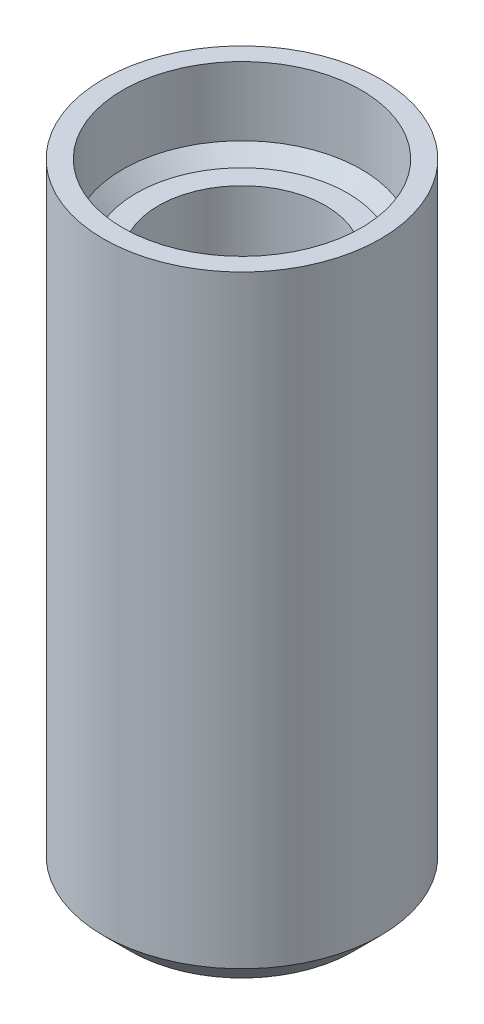
from build123d import *

# Parameters (mm, degrees)
SKETCH1_R           = 5.05
BOSS_EXTRUDE1_DEPTH = 20
SKETCH2_R           = 5.05
BOSS_EXTRUDE2_DEPTH = 2
SKETCH4_R           = 5.05
SKETCH4_R_2         = 4.35
BOSS_EXTRUDE3_DEPTH = 3
CHAMFER1_SIZE       = 1
CHAMFER2_SIZE       = 0.5
CUT_EXTRUDE1_DEPTH  = 0.4
BOSS_EXTRUDE4_DEPTH = 0.4


with BuildPart() as part:
    # Sketch1 → Boss-Extrude1 (new body)
    with BuildSketch(Plane(origin=(0, 0, 0), x_dir=(1, 0, 0), z_dir=(0, 1, 0))):
        Circle(SKETCH1_R)
        with BuildLine():
            Line((2.565151068, -1.65), (-2.565151068, -1.65))
            ThreePointArc((-2.565151068, -1.65), (0, 3.05), (2.565151068, -1.65))
        make_face(mode=Mode.SUBTRACT)
    extrude(amount=BOSS_EXTRUDE1_DEPTH)

    # Sketch2 → Boss-Extrude2 (add)
    with BuildSketch(Plane.XZ):
        Circle(SKETCH2_R)
    extrude(amount=-BOSS_EXTRUDE2_DEPTH)

    # Sketch4 → Boss-Extrude3 (add)
    with BuildSketch(Plane(origin=(0, 20, 0), x_dir=(1, 0, 0), z_dir=(0, 1, 0))):
        Circle(SKETCH4_R)
        Circle(SKETCH4_R_2, mode=Mode.SUBTRACT)
    extrude(amount=BOSS_EXTRUDE3_DEPTH)

    # Chamfer1
    chamfer1_edges = [part.edges().sort_by_distance(p)[0] for p in [
        (-5.05, 0, 0),
    ]]
    chamfer(chamfer1_edges, length=CHAMFER1_SIZE)

    # Chamfer2
    chamfer2_edges = [part.edges().sort_by_distance(p)[0] for p in [
        (-4.35, 20, 0),
    ]]
    chamfer(chamfer2_edges, length=CHAMFER2_SIZE)

    # Sketch5 → Cut-Extrude1 (cut)
    with BuildSketch(Plane.XZ):
        with BuildLine():
            add(Edge.make_bspline(
                [(1.439948587, 1.977857971), (1.439594418, 1.947179654), (1.438935589, 1.890111525), (1.433429057, 1.809777002), (1.4270814, 1.738210124), (1.415791341, 1.673161074), (1.401758418, 1.611967409), (1.383694724, 1.553469012), (1.360250697, 1.495084377), (1.344290938, 1.455538989), (1.3359523, 1.434877358)],
                knots=[0, 0, 0, 0, 1.319916943, 2.455323438, 3.464378594, 4.409964608, 5.293693962, 6.16476111, 7.041126412, 8, 8, 8, 8], degree=3))
            Line((1.3359523, 1.434877358), (-0.095996572, -1.863004891))
            add(Edge.make_bspline(
                [(-0.095996572, -1.863004891), (-0.103079107, -1.876394255), (-0.116801963, -1.902336991), (-0.147305, -1.934724111), (-0.187086931, -1.960386537), (-0.239296836, -1.977294348), (-0.304915975, -1.988596283), (-0.385818734, -1.996283375), (-0.48528424, -1.999725841), (-0.557978054, -1.999902688), (-0.597978649, -2)],
                knots=[0, 0, 0, 0, 0.659157871, 1.277159907, 1.919215029, 2.706578835, 3.654550683, 4.825028497, 6.252935909, 8, 8, 8, 8], degree=3))
            add(Edge.make_bspline(
                [(-0.597978649, -2), (-0.625646307, -1.999758185), (-0.678321934, -1.9992978), (-0.752656112, -1.997243092), (-0.818062696, -1.994695895), (-0.888304548, -1.988430727), (-0.958433008, -1.977833702), (-1.023374206, -1.957539704), (-1.066059389, -1.928063191), (-1.084465051, -1.886594158), (-1.075244849, -1.84032981), (-1.062893647, -1.810018016), (-1.055962297, -1.793007391)],
                knots=[0, 0, 0, 0, 1.340733497, 2.552582398, 3.603595853, 4.511719735, 5.969543587, 7.032159891, 7.791487141, 8.406546244, 9.105772362, 10, 10, 10, 10], degree=3))
            Line((-1.055962297, -1.793007391), (0.479982862, 1.583872038))
            Line((0.479982862, 1.583872038), (-1.361951372, 1.583872038))
            add(Edge.make_bspline(
                [(-1.361951372, 1.583872038), (-1.373186676, 1.58506365), (-1.395682225, 1.587449518), (-1.426552523, 1.606459502), (-1.451528664, 1.636792347), (-1.471697595, 1.678580357), (-1.485840367, 1.732872878), (-1.496339641, 1.800191364), (-1.503298216, 1.881054757), (-1.503720072, 1.939510124), (-1.503946302, 1.970858221)],
                knots=[0, 0, 0, 0, 0.598321547, 1.197971223, 1.880978557, 2.678740619, 3.66131666, 4.872497088, 6.322801311, 8, 8, 8, 8], degree=3))
            add(Edge.make_bspline(
                [(-1.503946302, 1.970858221), (-1.503286786, 2.002200854), (-1.502071109, 2.059974382), (-1.495545332, 2.140283922), (-1.483914888, 2.206907787), (-1.468596712, 2.261555537), (-1.448030384, 2.302497667), (-1.424522994, 2.332809913), (-1.394541503, 2.348890816), (-1.373440846, 2.350863809), (-1.362951336, 2.351844618)],
                knots=[0, 0, 0, 0, 1.704210039, 3.141351516, 4.374755511, 5.377959938, 6.212691607, 6.855400814, 7.430999487, 8, 8, 8, 8], degree=3))
            Line((-1.362951336, 2.351844618), (1.227956156, 2.351844618))
            add(Edge.make_bspline(
                [(1.227956156, 2.351844618), (1.246335593, 2.351328223), (1.280027794, 2.350381596), (1.326933096, 2.342161898), (1.367855013, 2.323363855), (1.395052486, 2.284862428), (1.416399912, 2.234640447), (1.430232996, 2.166777773), (1.438775132, 2.079423303), (1.439528445, 2.014222225), (1.439948587, 1.977857971)],
                knots=[0, 0, 0, 0, 0.878550269, 1.610511387, 2.273921182, 2.966412775, 3.802073521, 4.881614106, 6.260799084, 8, 8, 8, 8], degree=3))
        make_face()
    extrude(amount=-CUT_EXTRUDE1_DEPTH, mode=Mode.SUBTRACT)


with BuildPart() as body_2:
    # Sketch5<2> → Boss-Extrude4 (new body)
    with BuildSketch(Plane.XZ):
        with BuildLine():
            add(Edge.make_bspline(
                [(1.439948587, 1.977857971), (1.439594418, 1.947179654), (1.438935589, 1.890111525), (1.433429057, 1.809777002), (1.4270814, 1.738210124), (1.415791341, 1.673161074), (1.401758418, 1.611967409), (1.383694724, 1.553469012), (1.360250697, 1.495084377), (1.344290938, 1.455538989), (1.3359523, 1.434877358)],
                knots=[0, 0, 0, 0, 1.319916943, 2.455323438, 3.464378594, 4.409964608, 5.293693962, 6.16476111, 7.041126412, 8, 8, 8, 8], degree=3))
            Line((1.3359523, 1.434877358), (-0.095996572, -1.863004891))
            add(Edge.make_bspline(
                [(-0.095996572, -1.863004891), (-0.103079107, -1.876394255), (-0.116801963, -1.902336991), (-0.147305, -1.934724111), (-0.187086931, -1.960386537), (-0.239296836, -1.977294348), (-0.304915975, -1.988596283), (-0.385818734, -1.996283375), (-0.48528424, -1.999725841), (-0.557978054, -1.999902688), (-0.597978649, -2)],
                knots=[0, 0, 0, 0, 0.659157871, 1.277159907, 1.919215029, 2.706578835, 3.654550683, 4.825028497, 6.252935909, 8, 8, 8, 8], degree=3))
            add(Edge.make_bspline(
                [(-0.597978649, -2), (-0.625646307, -1.999758185), (-0.678321934, -1.9992978), (-0.752656112, -1.997243092), (-0.818062696, -1.994695895), (-0.888304548, -1.988430727), (-0.958433008, -1.977833702), (-1.023374206, -1.957539704), (-1.066059389, -1.928063191), (-1.084465051, -1.886594158), (-1.075244849, -1.84032981), (-1.062893647, -1.810018016), (-1.055962297, -1.793007391)],
                knots=[0, 0, 0, 0, 1.340733497, 2.552582398, 3.603595853, 4.511719735, 5.969543587, 7.032159891, 7.791487141, 8.406546244, 9.105772362, 10, 10, 10, 10], degree=3))
            Line((-1.055962297, -1.793007391), (0.479982862, 1.583872038))
            Line((0.479982862, 1.583872038), (-1.361951372, 1.583872038))
            add(Edge.make_bspline(
                [(-1.361951372, 1.583872038), (-1.373186676, 1.58506365), (-1.395682225, 1.587449518), (-1.426552523, 1.606459502), (-1.451528664, 1.636792347), (-1.471697595, 1.678580357), (-1.485840367, 1.732872878), (-1.496339641, 1.800191364), (-1.503298216, 1.881054757), (-1.503720072, 1.939510124), (-1.503946302, 1.970858221)],
                knots=[0, 0, 0, 0, 0.598321547, 1.197971223, 1.880978557, 2.678740619, 3.66131666, 4.872497088, 6.322801311, 8, 8, 8, 8], degree=3))
            add(Edge.make_bspline(
                [(-1.503946302, 1.970858221), (-1.503286786, 2.002200854), (-1.502071109, 2.059974382), (-1.495545332, 2.140283922), (-1.483914888, 2.206907787), (-1.468596712, 2.261555537), (-1.448030384, 2.302497667), (-1.424522994, 2.332809913), (-1.394541503, 2.348890816), (-1.373440846, 2.350863809), (-1.362951336, 2.351844618)],
                knots=[0, 0, 0, 0, 1.704210039, 3.141351516, 4.374755511, 5.377959938, 6.212691607, 6.855400814, 7.430999487, 8, 8, 8, 8], degree=3))
            Line((-1.362951336, 2.351844618), (1.227956156, 2.351844618))
            add(Edge.make_bspline(
                [(1.227956156, 2.351844618), (1.246335593, 2.351328223), (1.280027794, 2.350381596), (1.326933096, 2.342161898), (1.367855013, 2.323363855), (1.395052486, 2.284862428), (1.416399912, 2.234640447), (1.430232996, 2.166777773), (1.438775132, 2.079423303), (1.439528445, 2.014222225), (1.439948587, 1.977857971)],
                knots=[0, 0, 0, 0, 0.878550269, 1.610511387, 2.273921182, 2.966412775, 3.802073521, 4.881614106, 6.260799084, 8, 8, 8, 8], degree=3))
        make_face()
    extrude(amount=-BOSS_EXTRUDE4_DEPTH)


solid = Compound([part.part, body_2.part])
